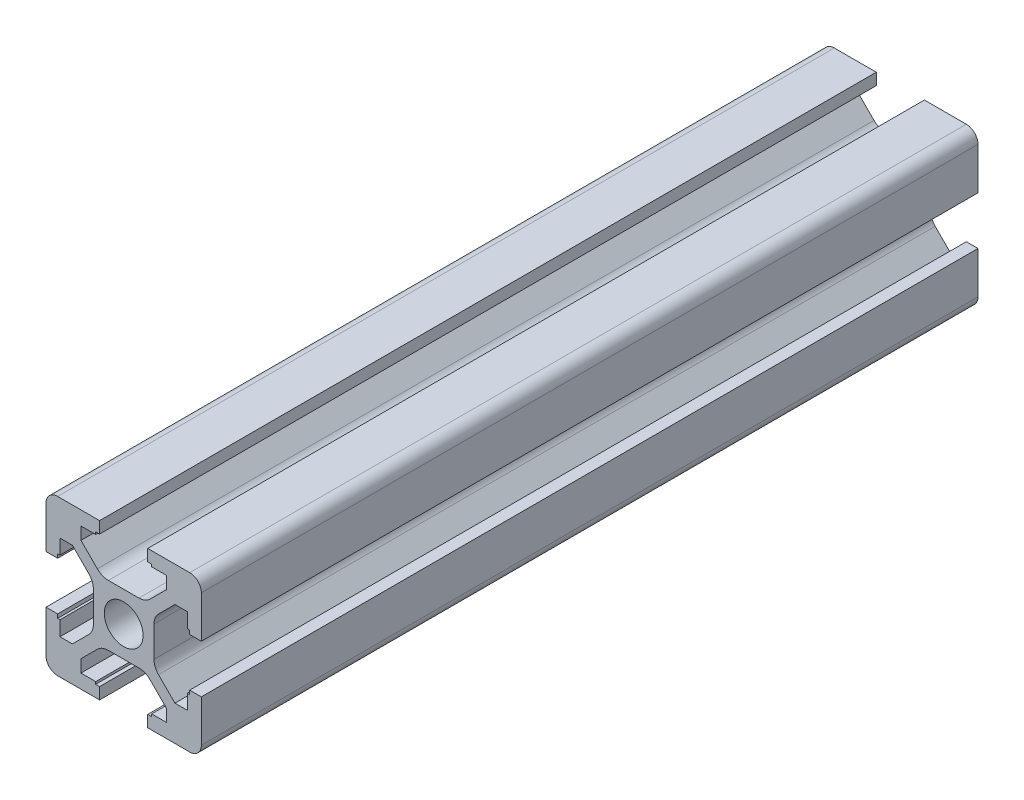
from build123d import *

# Parameters (mm, degrees)
SKETCH1_R           = 2.5
BOSS_EXTRUDE1_DEPTH = 100


with BuildPart() as part:
    # Sketch1 → Boss-Extrude1 (new body)
    with BuildSketch(Plane.XY):
        with BuildLine():
            Line((1.971572875, 3.9), (-1.971572875, 3.9))
            ThreePointArc((-1.971572875, 3.9), (-2.73693974, 4.052240935), (-3.385786438, 4.485786438))
            Line((-3.385786438, 4.485786438), (-5.5, 6.6))
            Line((-5.5, 6.6), (-5.5, 8.2))
            Line((-5.5, 8.2), (-3.6, 8.2))
            Line((-3.6, 8.2), (-3.6, 8.5))
            Line((-3.6, 8.5), (-3.1, 8.5))
            Line((-3.1, 8.5), (-3.1, 10))
            Line((-3.1, 10), (-8.5, 10))
            ThreePointArc((-8.5, 10), (-9.560660172, 9.560660172), (-10, 8.5))
            Line((-10, 8.5), (-10, 3.1))
            Line((-10, 3.1), (-8.5, 3.1))
            Line((-8.5, 3.1), (-8.5, 3.6))
            Line((-8.5, 3.6), (-8.2, 3.6))
            Line((-8.2, 3.6), (-8.2, 5.5))
            Line((-8.2, 5.5), (-6.6, 5.5))
            Line((-6.6, 5.5), (-4.485786438, 3.385786438))
            ThreePointArc((-4.485786438, 3.385786438), (-4.052240935, 2.73693974), (-3.9, 1.971572875))
            Line((-3.9, 1.971572875), (-3.9, -1.971572875))
            ThreePointArc((-3.9, -1.971572875), (-4.052240935, -2.73693974), (-4.485786438, -3.385786438))
            Line((-4.485786438, -3.385786438), (-6.6, -5.5))
            Line((-6.6, -5.5), (-8.2, -5.5))
            Line((-8.2, -5.5), (-8.2, -3.6))
            Line((-8.2, -3.6), (-8.5, -3.6))
            Line((-8.5, -3.6), (-8.5, -3.1))
            Line((-8.5, -3.1), (-10, -3.1))
            Line((-10, -3.1), (-10, -8.5))
            ThreePointArc((-10, -8.5), (-9.560660172, -9.560660172), (-8.5, -10))
            Line((-8.5, -10), (-3.1, -10))
            Line((-3.1, -10), (-3.1, -8.5))
            Line((-3.1, -8.5), (-3.6, -8.5))
            Line((-3.6, -8.5), (-3.6, -8.2))
            Line((-3.6, -8.2), (-5.5, -8.2))
            Line((-5.5, -8.2), (-5.5, -6.6))
            Line((-5.5, -6.6), (-3.385786438, -4.485786438))
            ThreePointArc((-3.385786438, -4.485786438), (-2.73693974, -4.052240935), (-1.971572875, -3.9))
            Line((-1.971572875, -3.9), (1.971572875, -3.9))
            ThreePointArc((1.971572875, -3.9), (2.73693974, -4.052240935), (3.385786438, -4.485786438))
            Line((3.385786438, -4.485786438), (5.5, -6.6))
            Line((5.5, -6.6), (5.5, -8.2))
            Line((5.5, -8.2), (3.6, -8.2))
            Line((3.6, -8.2), (3.6, -8.5))
            Line((3.6, -8.5), (3.1, -8.5))
            Line((3.1, -8.5), (3.1, -10))
            Line((3.1, -10), (8.5, -10))
            ThreePointArc((8.5, -10), (9.560660172, -9.560660172), (10, -8.5))
            Line((10, -8.5), (10, -3.1))
            Line((10, -3.1), (8.5, -3.1))
            Line((8.5, -3.1), (8.5, -3.6))
            Line((8.5, -3.6), (8.2, -3.6))
            Line((8.2, -3.6), (8.2, -5.5))
            Line((8.2, -5.5), (6.6, -5.5))
            Line((6.6, -5.5), (4.485786438, -3.385786438))
            ThreePointArc((4.485786438, -3.385786438), (4.052240935, -2.73693974), (3.9, -1.971572875))
            Line((3.9, -1.971572875), (3.9, 1.971572875))
            ThreePointArc((3.9, 1.971572875), (4.052240935, 2.73693974), (4.485786438, 3.385786438))
            Line((4.485786438, 3.385786438), (6.6, 5.5))
            Line((6.6, 5.5), (8.2, 5.5))
            Line((8.2, 5.5), (8.2, 3.6))
            Line((8.2, 3.6), (8.5, 3.6))
            Line((8.5, 3.6), (8.5, 3.1))
            Line((8.5, 3.1), (10, 3.1))
            Line((10, 3.1), (10, 8.5))
            ThreePointArc((10, 8.5), (9.560660172, 9.560660172), (8.5, 10))
            Line((8.5, 10), (3.1, 10))
            Line((3.1, 10), (3.1, 8.5))
            Line((3.1, 8.5), (3.6, 8.5))
            Line((3.6, 8.5), (3.6, 8.2))
            Line((3.6, 8.2), (5.5, 8.2))
            Line((5.5, 8.2), (5.5, 6.6))
            Line((5.5, 6.6), (3.385786438, 4.485786438))
            ThreePointArc((3.385786438, 4.485786438), (2.73693974, 4.052240935), (1.971572875, 3.9))
        make_face()
        Circle(SKETCH1_R, mode=Mode.SUBTRACT)
    extrude(amount=BOSS_EXTRUDE1_DEPTH)


solid = part.part
